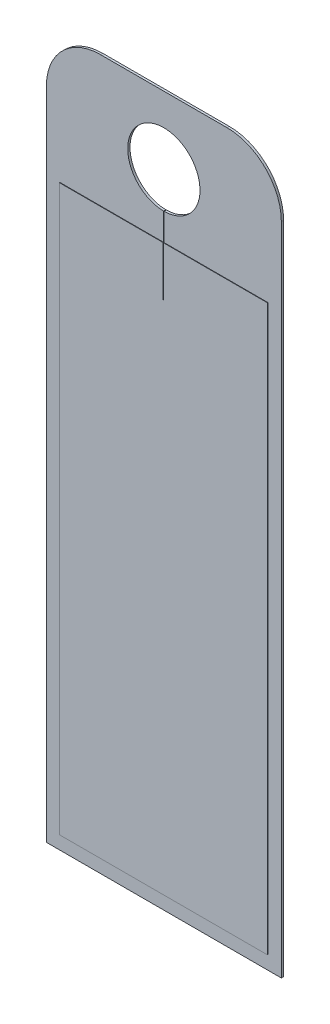
from build123d import *

# Parameters (mm, degrees)
SKETCH2_R                = 8
BOSS_EXTRUDE1_DEPTH      = 0.5
BOSS_EXTRUDE2_DEPTH      = 0.1
BOSS_EXTRUDE2_DEPTH_BACK = 0.6
SKETCH4_W                = 46
SKETCH4_H                = 125
CUT_EXTRUDE1_DEPTH       = 145.361906333
CUT_EXTRUDE1_DEPTH_BACK  = 145.361906333
SKETCH5_W                = 0.1
SKETCH5_H                = 25


with BuildPart() as part:
    # Sketch2 → Boss-Extrude1 (new body)
    with BuildSketch(Plane.XY):
        with BuildLine():
            Line((-14, 15), (14, 15))
            ThreePointArc((14, 15), (22.485281374, 11.485281374), (26, 3))
            Line((26, 3), (26, -142))
            Line((26, -142), (-26, -142))
            Line((-26, -142), (-26, 3))
            ThreePointArc((-26, 3), (-22.485281374, 11.485281374), (-14, 15))
        make_face()
        Circle(SKETCH2_R, mode=Mode.SUBTRACT)
    extrude(amount=BOSS_EXTRUDE1_DEPTH)

    # Sketch4 → Boss-Extrude2 (add, two sides: drawn at the far end of the back side and taken through both)
    with BuildSketch(Plane.XY.offset(0.5).offset(-BOSS_EXTRUDE2_DEPTH_BACK)):
        with Locations((0, -76.5)):
            Rectangle(SKETCH4_W, SKETCH4_H)
    extrude(amount=BOSS_EXTRUDE2_DEPTH + BOSS_EXTRUDE2_DEPTH_BACK)

    # Sketch5 → Cut-Extrude1 (cut, two sides: drawn at the far end of the back side and taken through both)
    with BuildSketch(Plane.XY.offset(0.5).offset(-CUT_EXTRUDE1_DEPTH_BACK)):
        with Locations((0, -12.5)):
            Rectangle(SKETCH5_W, SKETCH5_H)
    extrude(amount=CUT_EXTRUDE1_DEPTH + CUT_EXTRUDE1_DEPTH_BACK, mode=Mode.SUBTRACT)


solid = part.part
